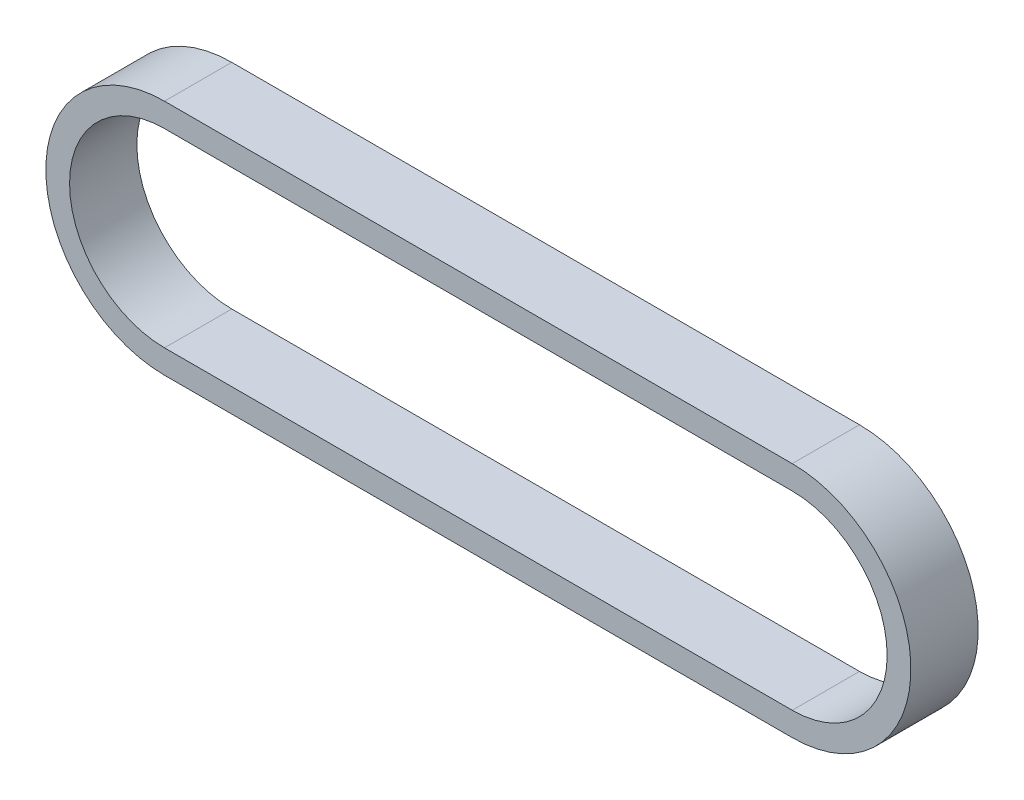
from build123d import *

# Parameters (mm, degrees)
BOSS_EXTRUDE1_DEPTH = 9


with BuildPart() as part:
    # Sketch1 → Boss-Extrude1 (new body)
    with BuildSketch(Plane.XY):
        with BuildLine():
            Line((0, 15.875), (83.975, 15.875))
            ThreePointArc((83.975, 15.875), (99.85, 0), (83.975, -15.875))
            Line((83.975, -15.875), (0, -15.875))
            ThreePointArc((0, -15.875), (-15.875, 0), (0, 15.875))
        make_face()
        with BuildLine():
            Line((0, 12.7), (83.975, 12.7))
            ThreePointArc((83.975, 12.7), (96.675, 0), (83.975, -12.7))
            Line((83.975, -12.7), (0, -12.7))
            ThreePointArc((0, -12.7), (-12.7, 0), (0, 12.7))
        make_face(mode=Mode.SUBTRACT)
    extrude(amount=BOSS_EXTRUDE1_DEPTH)


solid = part.part
